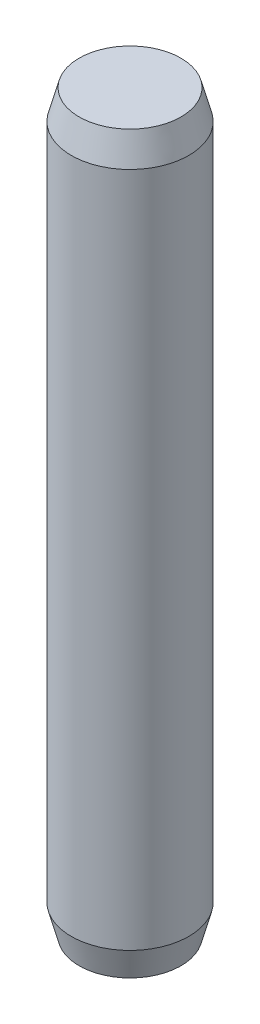
from build123d import *


with BuildPart() as part:
    # 草图2 → 旋转1 (revolve)
    with BuildSketch(Plane.XY):
        Polygon((1.732050808, 25), (2, 24), (2, 1), (1.732050808, 0), (0, 0), (0, 25), align=None)
    revolve(axis=Axis((0, 0, 0), (0, 1, 0)))


solid = part.part
